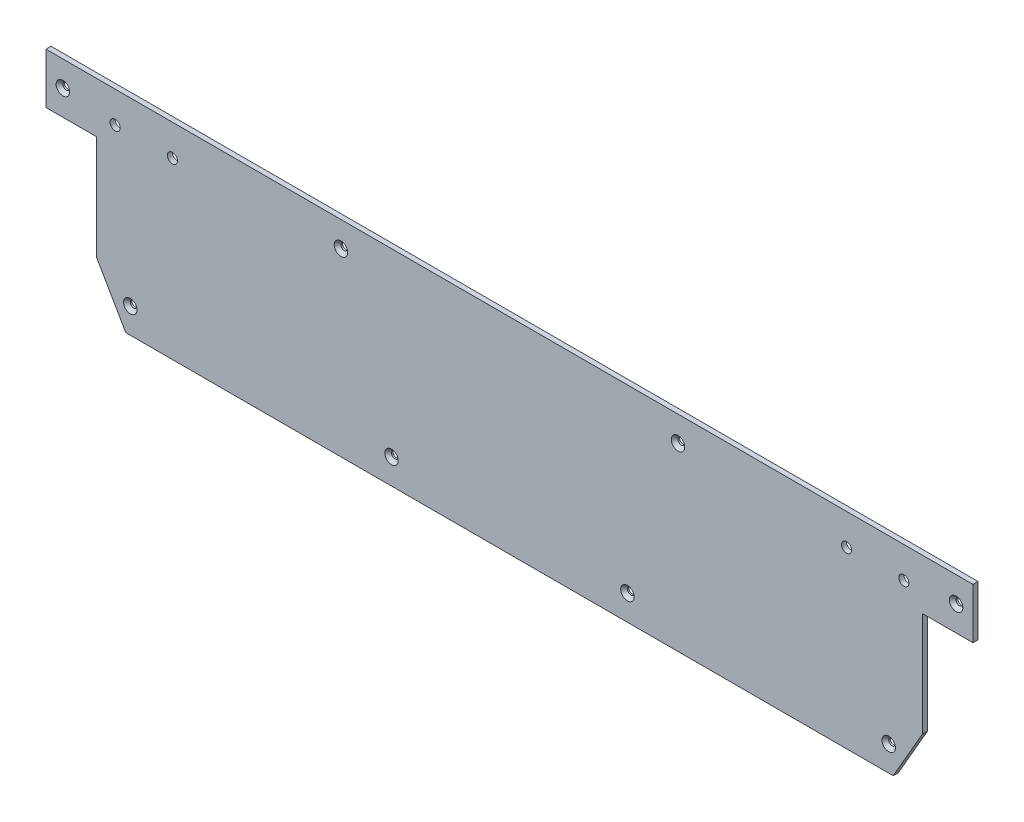
from build123d import *

# Parameters (mm, degrees)
SKETCH_1_W          = 550
SKETCH_1_H          = 122
EXTRUDE_1_DEPTH     = 3
CUT_EXTRUDE_2_DEPTH = 282.700195243
SKETCH_2_R          = 3
SKETCH_2_R_2        = 2
CUT_EXTRUDE_1_DEPTH = 10
CHAMFER_1_SIZE      = 2


with BuildPart() as part:
    # 草图1 → 凸台-拉伸1 (new body)
    with BuildSketch(Plane.XY):
        Rectangle(SKETCH_1_W, SKETCH_1_H)
    extrude(amount=EXTRUDE_1_DEPTH)

    # 草图3 → 切除-拉伸2 (cut, through all)
    with BuildSketch(Plane.XY.offset(3)):
        Polygon((-275, 31), (-245, 31), (-245, -31), (-227.679491924, -61), (-275, -61), align=None)
        Polygon((245, -31), (227.679491924, -61), (275, -61), (275, 31), (245, 31), align=None)
    extrude(amount=-CUT_EXTRUDE_2_DEPTH, mode=Mode.SUBTRACT)

    # 草图2 → 切除-拉伸1 (cut)
    with BuildSketch(Plane.XY):
        with Locations((-200, 42.5)):
            Circle(SKETCH_2_R)
        with Locations((-234, 42.5)):
            Circle(SKETCH_2_R)
        with Locations(Location((234, 42.5, 0), (0, 0, 180))):
            Circle(SKETCH_2_R)
        with Locations(Location((200, 42.5, 0), (0, 0, 180))):
            Circle(SKETCH_2_R)
        with Locations((-265, 46)):
            Circle(SKETCH_2_R_2)
        with Locations((-100, 46)):
            Circle(SKETCH_2_R_2)
        with Locations((-225, -46)):
            Circle(SKETCH_2_R_2)
        with Locations((-70, -46)):
            Circle(SKETCH_2_R_2)
        with Locations(Location((225, -46, 0), (0, 0, 180))):
            Circle(SKETCH_2_R_2)
        with Locations(Location((70, -46, 0), (0, 0, 180))):
            Circle(SKETCH_2_R_2)
        with Locations(Location((100, 46, 0), (0, 0, 180))):
            Circle(SKETCH_2_R_2)
        with Locations(Location((265, 46, 0), (0, 0, 180))):
            Circle(SKETCH_2_R_2)
    extrude(amount=CUT_EXTRUDE_1_DEPTH, mode=Mode.SUBTRACT)

    # 倒角1
    chamfer_1_edges = [part.edges().sort_by_distance(p)[0] for p in [
        (227, -46, 3),
        (-72, -46, 3),
        (-227, -46, 3),
        (-102, 46, 3),
        (-267, 46, 3),
        (72, -46, 3),
        (102, 46, 3),
        (267, 46, 3),
    ]]
    chamfer(chamfer_1_edges, length=CHAMFER_1_SIZE)


solid = part.part
